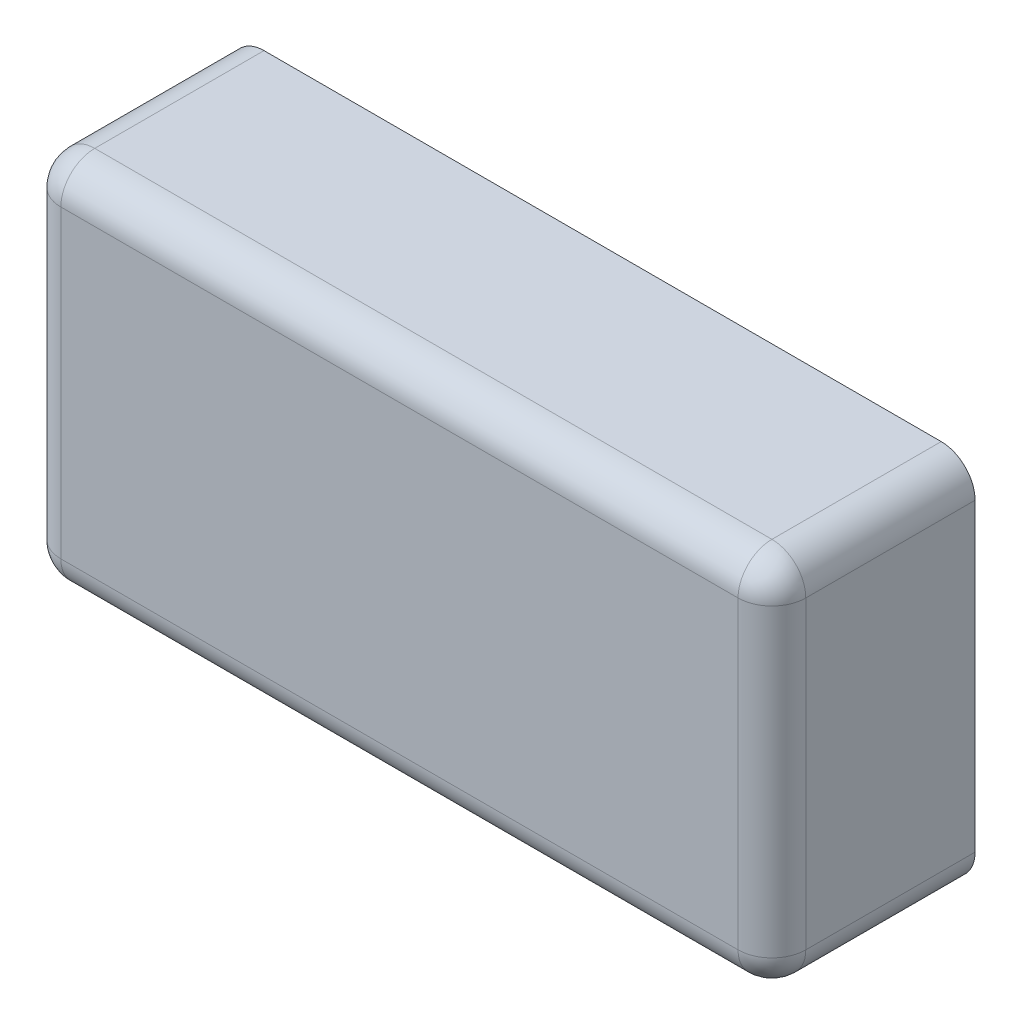
from build123d import *

# Parameters (mm, degrees)
SKETCH1_W           = 110
SKETCH1_H           = 55
BOSS_EXTRUDE1_DEPTH = 30
FILLET1_R           = 5


with BuildPart() as part:
    # Sketch1 → Boss-Extrude1 (new body)
    with BuildSketch(Plane.XY):
        with Locations((5.939349112, -2.928994083)):
            Rectangle(SKETCH1_W, SKETCH1_H)
    extrude(amount=BOSS_EXTRUDE1_DEPTH)

    # Fillet1
    fillet1_edges = [part.edges().sort_by_distance(p)[0] for p in [
        (60.939349112, -2.928994083, 30),
        (5.939349112, 24.571005917, 30),
        (-49.060650888, -2.928994083, 30),
        (5.939349112, -30.428994083, 30),
        (-49.060650888, 24.571005917, 15),
        (60.939349112, 24.571005917, 15),
        (60.939349112, -30.428994083, 15),
        (-49.060650888, -30.428994083, 15),
    ]]
    fillet(fillet1_edges, radius=FILLET1_R)


solid = part.part
